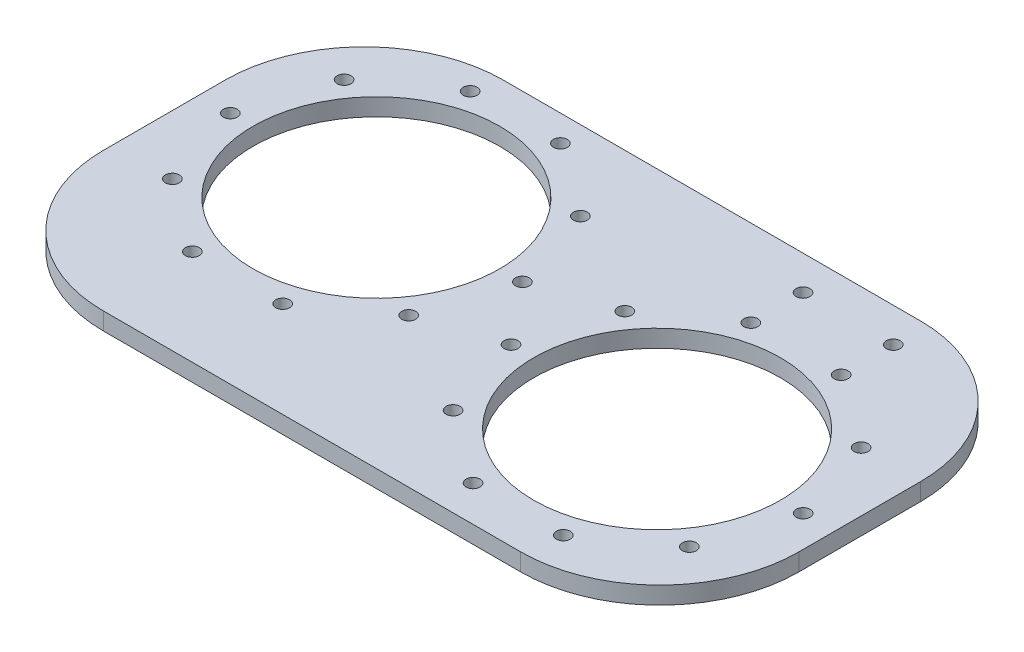
from build123d import *

# Parameters (mm, degrees)
SKETCH_1_R               = 35.5
EXTRUDE_1_DEPTH          = 5
CUT_EXTRUDE_1_REACH      = 117.461
SKETCH_2_R               = 2
PATTERN_CIRCULAR_1_COUNT = 10
CUT_EXTRUDE_2_REACH      = 117.461
SKETCH_3_R               = 2
PATTERN_CIRCULAR_2_COUNT = 10
CUT_EXTRUDE_3_REACH      = 117.461
SKETCH_4_R               = 2


with BuildPart() as part:
    # 草圖1 → 填料-伸長1 (new body)
    with BuildSketch(Plane(origin=(0, 0, 0), x_dir=(1, 0, 0), z_dir=(0, 1, 0))):
        with BuildLine():
            Line((-60, 57.5), (60, 57.5))
            ThreePointArc((60, 57.5), (88.284271247, 45.784271247), (100, 17.5))
            Line((100, 17.5), (100, -17.5))
            ThreePointArc((100, -17.5), (88.284271247, -45.784271247), (60, -57.5))
            Line((60, -57.5), (-60, -57.5))
            ThreePointArc((-60, -57.5), (-88.284271247, -45.784271247), (-100, -17.5))
            Line((-100, -17.5), (-100, 17.5))
            ThreePointArc((-100, 17.5), (-88.284271247, 45.784271247), (-60, 57.5))
        make_face()
        with Locations(Location((-49, 10, 0), (0, 0, 270))):
            Circle(SKETCH_1_R, mode=Mode.SUBTRACT)
        with Locations(Location((49, -7.280044109, 0), (0, 0, 270))):
            Circle(SKETCH_1_R, mode=Mode.SUBTRACT)
    extrude(amount=EXTRUDE_1_DEPTH)

    # 草圖2 → 除料-伸長1 (cut, up to next)
    with BuildSketch(Plane(origin=(0, 5, 0), x_dir=(1, 0, 0), z_dir=(0, 1, 0)), mode=Mode.PRIVATE) as cut_extrude_1_sk1:
        with Locations(Location((91, -7.280044109, 0), (0, 0, 270))):
            Circle(SKETCH_2_R)
    cut_extrude_1_tool1 = extrude(cut_extrude_1_sk1.sketch, amount=-CUT_EXTRUDE_1_REACH, mode=Mode.PRIVATE) & part.part
    cut_extrude_1 = cut_extrude_1_tool1.solids().sort_by_distance((91, 5, 7.280044))[0]
    add(cut_extrude_1, mode=Mode.SUBTRACT)

    # 環狀複製排列1: 除料-伸長1 ×10 about axis
    pattern_circular_1_axis = Axis((49, 0, 7.280044109), (0, 1, 0))
    for i in range(1, PATTERN_CIRCULAR_1_COUNT):
        add(cut_extrude_1.rotate(pattern_circular_1_axis, i * 360 / PATTERN_CIRCULAR_1_COUNT), mode=Mode.SUBTRACT)

    # 草圖3 → 除料-伸長2 (cut, up to next)
    with BuildSketch(Plane(origin=(0, 5, 0), x_dir=(1, 0, 0), z_dir=(0, 1, 0)), mode=Mode.PRIVATE) as cut_extrude_2_sk1:
        with Locations(Location((-7, 10, 0), (0, 0, 270))):
            Circle(SKETCH_3_R)
    cut_extrude_2_tool1 = extrude(cut_extrude_2_sk1.sketch, amount=-CUT_EXTRUDE_2_REACH, mode=Mode.PRIVATE) & part.part
    cut_extrude_2 = cut_extrude_2_tool1.solids().sort_by_distance((-7, 5, -10))[0]
    add(cut_extrude_2, mode=Mode.SUBTRACT)

    # 環狀複製排列2: 除料-伸長2 ×10 about axis
    pattern_circular_2_axis = Axis((-49, 0, -10), (0, 1, 0))
    for i in range(1, PATTERN_CIRCULAR_2_COUNT):
        add(cut_extrude_2.rotate(pattern_circular_2_axis, i * 360 / PATTERN_CIRCULAR_2_COUNT), mode=Mode.SUBTRACT)

    # 草圖4 → 除料-伸長3 (cut, up to next)
    with BuildSketch(Plane(origin=(0, 5, 0), x_dir=(1, 0, 0), z_dir=(0, 1, 0)), mode=Mode.PRIVATE) as cut_extrude_3_sk1:
        with Locations(Location((36.021286236, 47.664329575, 0), (0, 0, 270))):
            Circle(SKETCH_4_R)
    cut_extrude_3_tool1 = extrude(cut_extrude_3_sk1.sketch, amount=-CUT_EXTRUDE_3_REACH, mode=Mode.PRIVATE) & part.part
    # 草圖4 → 除料-伸長3 (cut, up to next)
    with BuildSketch(Plane(origin=(0, 5, 0), x_dir=(1, 0, 0), z_dir=(0, 1, 0)), mode=Mode.PRIVATE) as cut_extrude_3_sk2:
        with Locations(Location((61.978713764, 47.664329575, 0), (0, 0, 270))):
            Circle(SKETCH_4_R)
    cut_extrude_3_tool2 = extrude(cut_extrude_3_sk2.sketch, amount=-CUT_EXTRUDE_3_REACH, mode=Mode.PRIVATE) & part.part
    add(cut_extrude_3_tool1.solids().sort_by_distance((36.021286, 5, -47.66433))[0], mode=Mode.SUBTRACT)
    add(cut_extrude_3_tool2.solids().sort_by_distance((61.978714, 5, -47.66433))[0], mode=Mode.SUBTRACT)


solid = part.part
